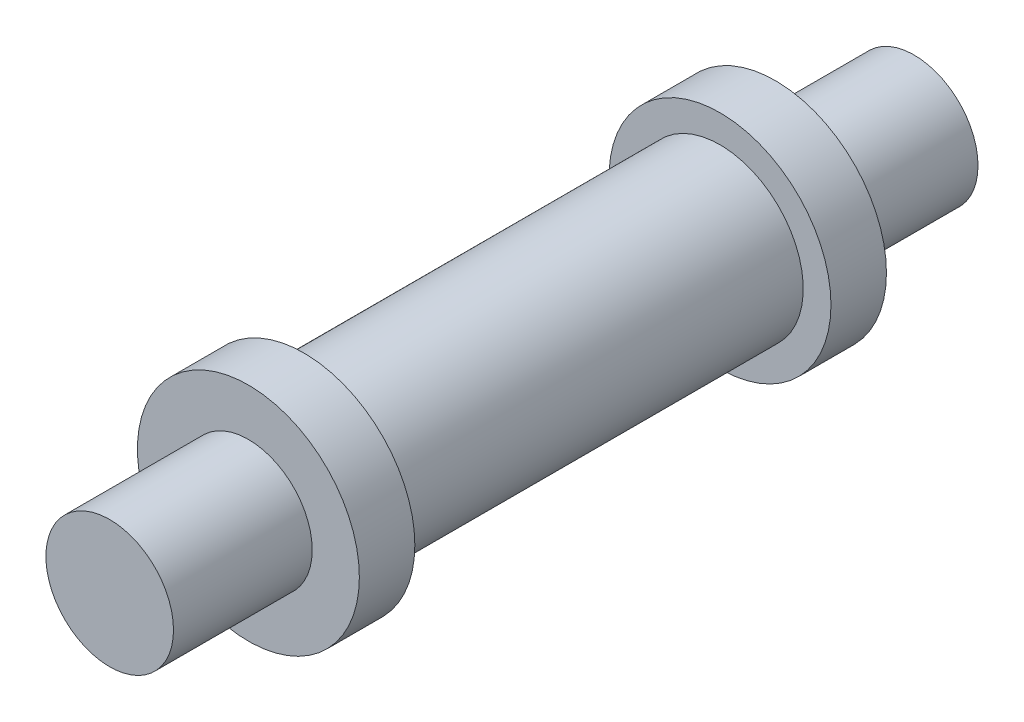
from build123d import *

# Parameters (mm, degrees)
SKETCH1_R           = 2.921
BOSS_EXTRUDE1_DEPTH = 6.35
SKETCH2_R           = 5.08
BOSS_EXTRUDE2_DEPTH = 2.54
SKETCH3_R           = 3.81
BOSS_EXTRUDE3_DEPTH = 19.05
SKETCH4_R           = 5.08
BOSS_EXTRUDE4_DEPTH = 2.54
SKETCH5_R           = 2.921
BOSS_EXTRUDE5_DEPTH = 6.35


with BuildPart() as part:
    # Sketch1 → Boss-Extrude1 (new body)
    with BuildSketch(Plane.XY):
        Circle(SKETCH1_R)
    extrude(amount=BOSS_EXTRUDE1_DEPTH)

    # Sketch2 → Boss-Extrude2 (add)
    with BuildSketch(Plane.XY.offset(6.35)):
        Circle(SKETCH2_R)
    extrude(amount=BOSS_EXTRUDE2_DEPTH)

    # Sketch3 → Boss-Extrude3 (add)
    with BuildSketch(Plane.XY.offset(8.89)):
        with Locations(Location((0, 0, 0), (0, 0, 180))):
            Circle(SKETCH3_R)
    extrude(amount=BOSS_EXTRUDE3_DEPTH)

    # Sketch4 → Boss-Extrude4 (add)
    with BuildSketch(Plane.XY.offset(27.94)):
        Circle(SKETCH4_R)
    extrude(amount=BOSS_EXTRUDE4_DEPTH)

    # Sketch5 → Boss-Extrude5 (add)
    with BuildSketch(Plane.XY.offset(30.48)):
        Circle(SKETCH5_R)
    extrude(amount=BOSS_EXTRUDE5_DEPTH)


solid = part.part
